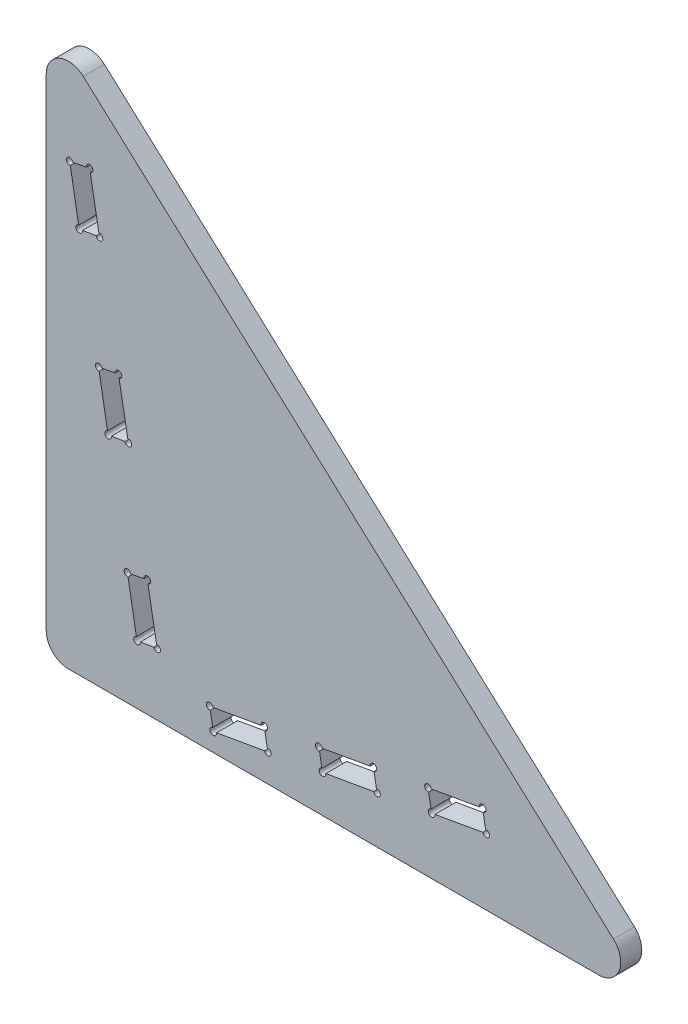
from build123d import *

# Parameters (mm, degrees)
BOSS_EXTRUDE1_DEPTH = 19


with BuildPart() as part:
    # Sketch1 → Boss-Extrude1 (new body)
    with BuildSketch(Plane.XY):
        with BuildLine():
            Line((0, 20), (0, 454.788965914))
            ThreePointArc((0, 454.788965914), (11.908928303, 473.079251828), (33.45345588, 469.587767382))
            Line((33.45345588, 469.587767382), (511.721318385, 34.798801468))
            ThreePointArc((511.721318385, 34.798801468), (516.922299368, 12.788066464), (498.267862505, 0))
            Line((498.267862505, 0), (20, 0))
            ThreePointArc((20, 0), (5.857864376, 5.857864376), (0, 20))
        make_face()
        with BuildLine():
            Line((24.130575607, 397.736018906), (36.207010666, 400.074453065))
            ThreePointArc((36.207010666, 400.074453065), (40.847447332, 403.119941065), (39.685090804, 397.692457586))
            Line((39.685090804, 397.692457586), (47.499326679, 354.391906577))
            ThreePointArc((47.499326679, 354.391906577), (50.482851851, 349.709309806), (45.071751319, 350.953546922))
            Line((45.071751319, 350.953546922), (32.73690061, 348.928341259))
            ThreePointArc((32.73690061, 348.928341259), (28.041339197, 345.995030056), (29.255591906, 351.396715159))
            Line((29.255591906, 351.396715159), (21.706228811, 394.21128083))
            ThreePointArc((21.706228811, 394.21128083), (18.713515198, 398.865809266), (24.130575607, 397.736018906))
        make_face(mode=Mode.SUBTRACT)
        with BuildLine():
            Line((50.177802257, 250.014855954), (62.254237316, 252.353290113))
            ThreePointArc((62.254237316, 252.353290113), (66.894673982, 255.398778113), (65.732317454, 249.971294634))
            Line((65.732317454, 249.971294634), (73.546553329, 206.670743625))
            ThreePointArc((73.546553329, 206.670743625), (76.530078501, 201.988146855), (71.118977969, 203.23238397))
            Line((71.118977969, 203.23238397), (58.78412726, 201.207178307))
            ThreePointArc((58.78412726, 201.207178307), (54.088565847, 198.273867104), (55.302818556, 203.675552207))
            Line((55.302818556, 203.675552207), (47.753455461, 246.490117878))
            ThreePointArc((47.753455461, 246.490117878), (44.760741848, 251.144646314), (50.177802257, 250.014855954))
        make_face(mode=Mode.SUBTRACT)
        with BuildLine():
            Line((76.225028907, 102.293693002), (88.301463966, 104.632127162))
            ThreePointArc((88.301463966, 104.632127162), (92.941900632, 107.677615161), (91.779544104, 102.250131683))
            Line((91.779544104, 102.250131683), (99.59377998, 58.949580674))
            ThreePointArc((99.59377998, 58.949580674), (102.577305151, 54.266983903), (97.166204619, 55.511221018))
            Line((97.166204619, 55.511221018), (84.83135391, 53.486015355))
            ThreePointArc((84.83135391, 53.486015355), (80.135792497, 50.552704152), (81.350045206, 55.954389255))
            Line((81.350045206, 55.954389255), (73.800682111, 98.768954926))
            ThreePointArc((73.800682111, 98.768954926), (70.807968498, 103.423483362), (76.225028907, 102.293693002))
        make_face(mode=Mode.SUBTRACT)
        with BuildLine():
            Line((248.921064371, 52.485302628), (292.252605504, 60.125822445))
            ThreePointArc((292.252605504, 60.125822445), (296.927758072, 63.104223111), (295.727973296, 57.692343719))
            Line((295.727973296, 57.692343719), (297.898575517, 45.382246806))
            ThreePointArc((297.898575517, 45.382246806), (300.876976182, 40.707094238), (295.46509679, 41.906879014))
            Line((295.46509679, 41.906879014), (252.133555658, 34.266359197))
            ThreePointArc((252.133555658, 34.266359197), (247.45840309, 31.287958531), (248.658187866, 36.699837923))
            Line((248.658187866, 36.699837923), (246.487585645, 49.009934835))
            ThreePointArc((246.487585645, 49.009934835), (243.509184979, 53.685087404), (248.921064371, 52.485302628))
        make_face(mode=Mode.SUBTRACT)
        with BuildLine():
            Line((150.44028907, 35.120484861), (193.771830203, 42.761004678))
            ThreePointArc((193.771830203, 42.761004678), (198.446982771, 45.739405344), (197.247197995, 40.327525952))
            Line((197.247197995, 40.327525952), (199.417800215, 28.01742904))
            ThreePointArc((199.417800215, 28.01742904), (202.396200881, 23.342276471), (196.984321489, 24.542061247))
            Line((196.984321489, 24.542061247), (153.652780357, 16.90154143))
            ThreePointArc((153.652780357, 16.90154143), (148.977627789, 13.923140764), (150.177412565, 19.335020156))
            Line((150.177412565, 19.335020156), (148.006810344, 31.645117069))
            ThreePointArc((148.006810344, 31.645117069), (145.028409678, 36.320269637), (150.44028907, 35.120484861))
        make_face(mode=Mode.SUBTRACT)
        with BuildLine():
            Line((347.401839672, 69.850120394), (390.733380805, 77.490640212))
            ThreePointArc((390.733380805, 77.490640212), (395.408533373, 80.469040877), (394.208748597, 75.057161485))
            Line((394.208748597, 75.057161485), (396.379350818, 62.747064573))
            ThreePointArc((396.379350818, 62.747064573), (399.357751483, 58.071912005), (393.945872092, 59.271696781))
            Line((393.945872092, 59.271696781), (350.614330959, 51.631176963))
            ThreePointArc((350.614330959, 51.631176963), (345.939178391, 48.652776298), (347.138963167, 54.064655689))
            Line((347.138963167, 54.064655689), (344.968360946, 66.374752602))
            ThreePointArc((344.968360946, 66.374752602), (341.98996028, 71.04990517), (347.401839672, 69.850120394))
        make_face(mode=Mode.SUBTRACT)
    extrude(amount=BOSS_EXTRUDE1_DEPTH)


solid = part.part
